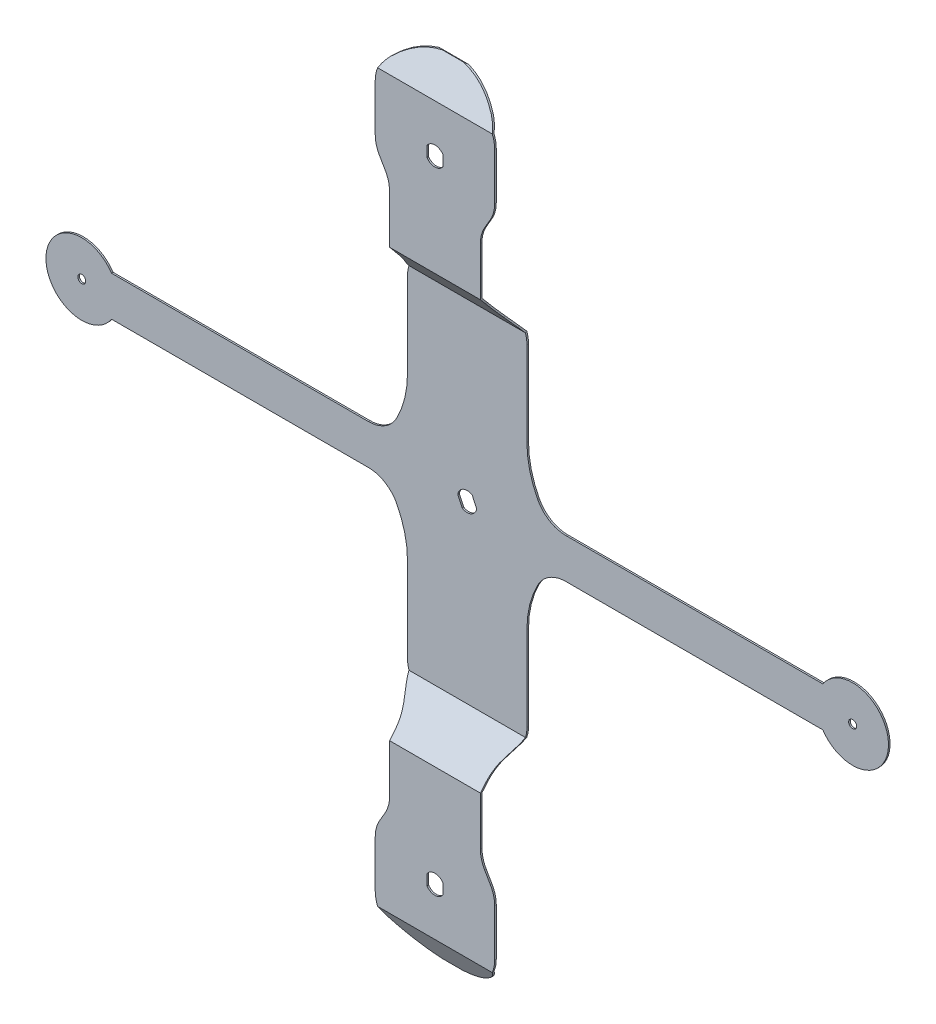
from build123d import *

# Parameters (mm, degrees)
SALIENTE_EXTRUIR1_DEPTH     = 271
CORTAR_EXTRUIR9_DEPTH       = 372.074494889
CORTAR_EXTRUIR9_DEPTH_BACK  = 372.074494889
CROQUIS4_R                  = 2.5
CORTAR_EXTRUIR11_DEPTH      = 372.074494889
CORTAR_EXTRUIR11_DEPTH_BACK = 372.074494889
CROQUIS2_W                  = 600.899293422
CROQUIS2_H                  = 554.061756016


with BuildPart() as part:
    # Croquis1 → Saliente-Extruir1 (new, symmetric)
    with BuildSketch(Plane(origin=(0, 0, 0), x_dir=(0, 0, -1), z_dir=(1, 0, 0))):
        Polygon((-36.5, -110), (-36.5, 110), (-56.747809705, 134.130399958), (-56.747809705, 198), (-56.747809705, 228), (-45.747809705, 247.052558883), (-44.881784301, 246.552558883), (-55.747809705, 227.732050808), (-55.747809705, 198), (-55.747809705, 134.494370193), (-35.5, 110.363970234), (-35.5, -110.363970234), (-55.747809705, -134.494370193), (-55.747809705, -198), (-55.747809705, -227.732050808), (-44.881784301, -246.552558883), (-45.747809705, -247.052558883), (-56.747809705, -228), (-56.747809705, -198), (-56.747809705, -134.130399958), align=None)
    extrude(amount=SALIENTE_EXTRUIR1_DEPTH, both=True)

    # Croquis4 → Cortar-Extruir9 (cut, two sides: drawn at the far end of the back side and taken through both)
    with BuildSketch(Plane.XY.offset(-CORTAR_EXTRUIR9_DEPTH_BACK)):
        with Locations(Location((-242, 0, 0), (0, 0, 180))):
            Circle(CROQUIS4_R)
        with Locations(Location((242, 0, 0), (0, 0, 180))):
            Circle(CROQUIS4_R)
        with BuildLine():
            Line((-5, 201.31662479), (-5, 194.68337521))
            ThreePointArc((-5, 194.68337521), (0, 192), (5, 194.68337521))
            Line((5, 194.68337521), (5, 201.31662479))
            ThreePointArc((5, 201.31662479), (0, 204), (-5, 201.31662479))
        make_face()
        with BuildLine():
            Line((5, -201.31662479), (5, -194.68337521))
            ThreePointArc((5, -194.68337521), (0, -192), (-5, -194.68337521))
            Line((-5, -194.68337521), (-5, -201.31662479))
            ThreePointArc((-5, -201.31662479), (0, -204), (5, -201.31662479))
        make_face()
        with BuildLine():
            Line((-5.933205139, 0.892791565), (-3.129872731, -5.118974183))
            ThreePointArc((-3.129872731, -5.118974183), (2.53570957, -5.437846722), (5.933205139, -0.892791565))
            Line((5.933205139, -0.892791565), (3.129872731, 5.118974183))
            ThreePointArc((3.129872731, 5.118974183), (-2.53570957, 5.437846722), (-5.933205139, 0.892791565))
        make_face()
    extrude(amount=CORTAR_EXTRUIR9_DEPTH + CORTAR_EXTRUIR9_DEPTH_BACK, mode=Mode.SUBTRACT)

    # Croquis2 → Cortar-Extruir11 (cut, two sides: drawn at the far end of the back side and taken through both)
    with BuildSketch(Plane.XY.offset(-CORTAR_EXTRUIR11_DEPTH_BACK)):
        Rectangle(CROQUIS2_W, CROQUIS2_H)
        with BuildLine():
            Line((-31.179491924, 174.57413175), (-34.820508076, 180.880556715))
            ThreePointArc((-34.820508076, 180.880556715), (-36.818516526, 185.704175813), (-37.5, 190.880556715))
            Line((-37.5, 190.880556715), (-37.5, 220.353571071))
            ThreePointArc((-37.5, 220.353571071), (-35.939088915, 228.099537764), (-31.5, 234.636427928))
            ThreePointArc((-31.5, 234.636427928), (0, 247.5), (31.5, 234.636427928))
            ThreePointArc((31.5, 234.636427928), (35.939088915, 228.099537764), (37.5, 220.353571071))
            Line((37.5, 220.353571071), (37.5, 190.880556715))
            ThreePointArc((37.5, 190.880556715), (36.818516526, 185.704175813), (34.820508076, 180.880556715))
            Line((34.820508076, 180.880556715), (31.179491924, 174.57413175))
            ThreePointArc((31.179491924, 174.57413175), (29.181483474, 169.750512652), (28.5, 164.57413175))
            Line((28.5, 164.57413175), (28.5, 130.292099447))
            ThreePointArc((28.5, 130.292099447), (29.181483474, 125.115718545), (31.179491924, 120.292099447))
            Line((31.179491924, 120.292099447), (34.820508076, 113.985674482))
            ThreePointArc((34.820508076, 113.985674482), (36.818516526, 109.162055384), (37.5, 103.985674482))
            Line((37.5, 103.985674482), (37.5, 50.768455322))
            ThreePointArc((37.5, 50.768455322), (39.221022598, 36.579915591), (44.28427417, 23.214285714))
            ThreePointArc((44.28427417, 23.214285714), (51.647000448, 15.386930642), (61.997983838, 12.5))
            Line((61.997983838, 12.5), (223.291713066, 12.5))
            ThreePointArc((223.291713066, 12.5), (264.5, 0), (223.291713066, -12.5))
            Line((223.291713066, -12.5), (61.997983838, -12.5))
            ThreePointArc((61.997983838, -12.5), (51.647000448, -15.386930642), (44.28427417, -23.214285714))
            ThreePointArc((44.28427417, -23.214285714), (39.221022598, -36.579915591), (37.5, -50.768455322))
            Line((37.5, -50.768455322), (37.5, -103.985674482))
            ThreePointArc((37.5, -103.985674482), (36.818516526, -109.162055384), (34.820508076, -113.985674482))
            Line((34.820508076, -113.985674482), (31.179491924, -120.292099447))
            ThreePointArc((31.179491924, -120.292099447), (29.181483474, -125.115718545), (28.5, -130.292099447))
            Line((28.5, -130.292099447), (28.5, -164.57413175))
            ThreePointArc((28.5, -164.57413175), (29.181483474, -169.750512652), (31.179491924, -174.57413175))
            Line((31.179491924, -174.57413175), (34.820508076, -180.880556715))
            ThreePointArc((34.820508076, -180.880556715), (36.818516526, -185.704175813), (37.5, -190.880556715))
            Line((37.5, -190.880556715), (37.5, -220.353571071))
            ThreePointArc((37.5, -220.353571071), (35.939088915, -228.099537764), (31.5, -234.636427928))
            ThreePointArc((31.5, -234.636427928), (0, -247.5), (-31.5, -234.636427928))
            ThreePointArc((-31.5, -234.636427928), (-35.939088915, -228.099537764), (-37.5, -220.353571071))
            Line((-37.5, -220.353571071), (-37.5, -190.880556715))
            ThreePointArc((-37.5, -190.880556715), (-36.818516526, -185.704175813), (-34.820508076, -180.880556715))
            Line((-34.820508076, -180.880556715), (-31.179491924, -174.57413175))
            ThreePointArc((-31.179491924, -174.57413175), (-29.181483474, -169.750512652), (-28.5, -164.57413175))
            Line((-28.5, -164.57413175), (-28.5, -130.292099447))
            ThreePointArc((-28.5, -130.292099447), (-29.181483474, -125.115718545), (-31.179491924, -120.292099447))
            Line((-31.179491924, -120.292099447), (-34.820508076, -113.985674482))
            ThreePointArc((-34.820508076, -113.985674482), (-36.818516526, -109.162055384), (-37.5, -103.985674482))
            Line((-37.5, -103.985674482), (-37.5, -50.768455322))
            ThreePointArc((-37.5, -50.768455322), (-39.221022598, -36.579915591), (-44.28427417, -23.214285714))
            ThreePointArc((-44.28427417, -23.214285714), (-51.647000448, -15.386930642), (-61.997983838, -12.5))
            Line((-61.997983838, -12.5), (-223.291713066, -12.5))
            ThreePointArc((-223.291713066, -12.5), (-264.5, 0), (-223.291713066, 12.5))
            Line((-223.291713066, 12.5), (-61.997983838, 12.5))
            ThreePointArc((-61.997983838, 12.5), (-51.647000448, 15.386930642), (-44.28427417, 23.214285714))
            ThreePointArc((-44.28427417, 23.214285714), (-39.221022598, 36.579915591), (-37.5, 50.768455322))
            Line((-37.5, 50.768455322), (-37.5, 103.985674482))
            ThreePointArc((-37.5, 103.985674482), (-36.818516526, 109.162055384), (-34.820508076, 113.985674482))
            Line((-34.820508076, 113.985674482), (-31.179491924, 120.292099447))
            ThreePointArc((-31.179491924, 120.292099447), (-29.181483474, 125.115718545), (-28.5, 130.292099447))
            Line((-28.5, 130.292099447), (-28.5, 164.57413175))
            ThreePointArc((-28.5, 164.57413175), (-29.181483474, 169.750512652), (-31.179491924, 174.57413175))
        make_face(mode=Mode.SUBTRACT)
    extrude(amount=CORTAR_EXTRUIR11_DEPTH + CORTAR_EXTRUIR11_DEPTH_BACK, mode=Mode.SUBTRACT)


solid = part.part
